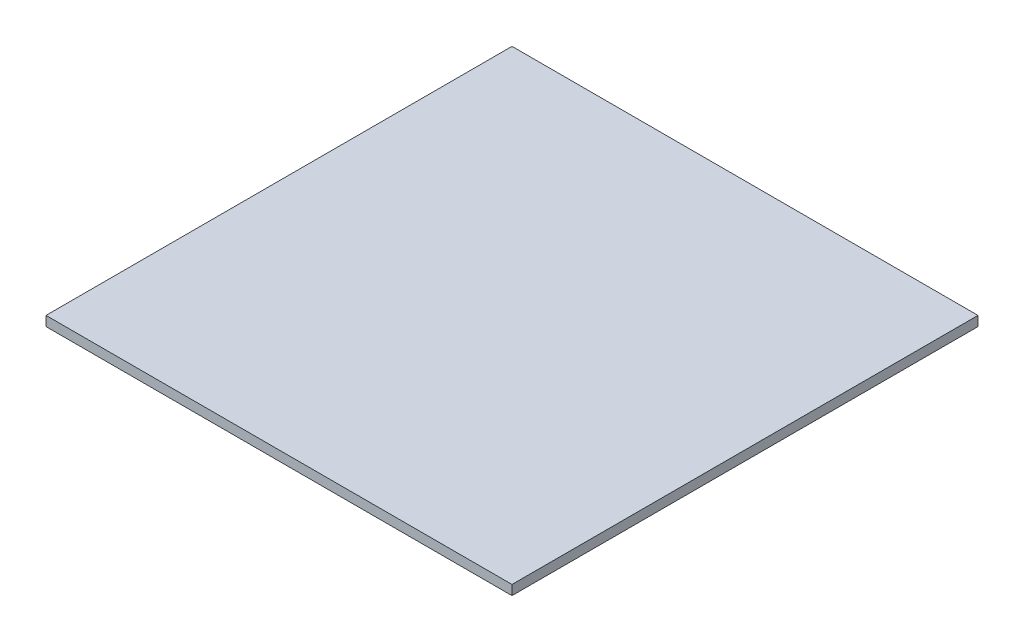
from build123d import *

# Parameters (mm, degrees)
SKETCH1_W           = 609.6
SKETCH1_H           = 609.6
BOSS_EXTRUDE1_DEPTH = 6.35


with BuildPart() as part:
    # Sketch1 → Boss-Extrude1 (new, symmetric)
    with BuildSketch(Plane(origin=(0, 0, 0), x_dir=(1, 0, 0), z_dir=(0, 1, 0))):
        Rectangle(SKETCH1_W, SKETCH1_H)
    extrude(amount=BOSS_EXTRUDE1_DEPTH, both=True)


solid = part.part
